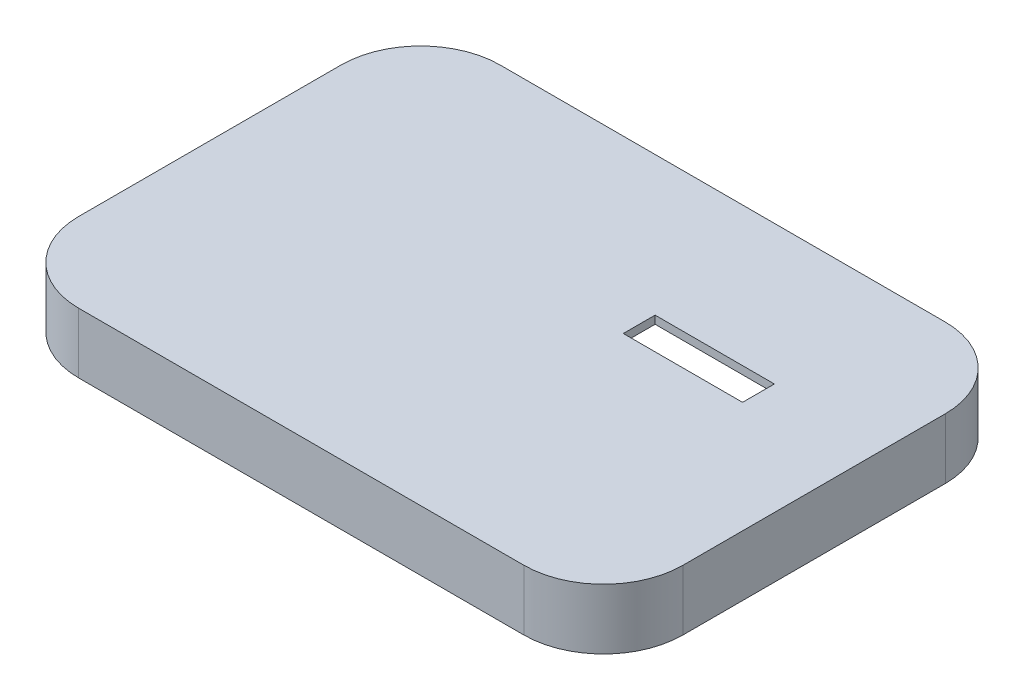
from build123d import *

# Parameters (mm, degrees)
SKETCH1_W           = 15
SKETCH1_H           = 4
BOSS_EXTRUDE1_DEPTH = 1
BOSS_EXTRUDE2_START = 6
BOSS_EXTRUDE2_DEPTH = 6
SKETCH3_W           = 10
SKETCH3_H           = 3
BOSS_EXTRUDE3_DEPTH = 3.5
BOSS_EXTRUDE4_START = 0.6
BOSS_EXTRUDE4_DEPTH = 0.6
SKETCH5_W           = 3
SKETCH5_H           = 10
BOSS_EXTRUDE5_DEPTH = 3.5


with BuildPart() as part:
    # Sketch1 → Boss-Extrude1 (new body)
    with BuildSketch(Plane(origin=(0, 0, 0), x_dir=(1, 0, 0), z_dir=(0, 1, 0))):
        with BuildLine():
            Line((-28, -26.5), (28, -26.5))
            ThreePointArc((28, -26.5), (35.071067812, -23.571067812), (38, -16.5))
            Line((38, -16.5), (38, 16.5))
            ThreePointArc((38, 16.5), (35.071067812, 23.571067812), (28, 26.5))
            Line((28, 26.5), (-28, 26.5))
            ThreePointArc((-28, 26.5), (-35.071067812, 23.571067812), (-38, 16.5))
            Line((-38, 16.5), (-38, -16.5))
            ThreePointArc((-38, -16.5), (-35.071067812, -23.571067812), (-28, -26.5))
        make_face()
        with Locations((16.5, 7)):
            Rectangle(SKETCH1_W, SKETCH1_H, mode=Mode.SUBTRACT)
    extrude(amount=BOSS_EXTRUDE1_DEPTH)

    # Sketch2 → Boss-Extrude2 (add)
    with BuildSketch(Plane.XZ.offset(BOSS_EXTRUDE2_START)):
        with BuildLine():
            Line((-28, -26.5), (28, -26.5))
            ThreePointArc((28, -26.5), (35.071067812, -23.571067812), (38, -16.5))
            Line((38, -16.5), (38, 16.5))
            ThreePointArc((38, 16.5), (35.071067812, 23.571067812), (28, 26.5))
            Line((28, 26.5), (-28, 26.5))
            ThreePointArc((-28, 26.5), (-35.071067812, 23.571067812), (-38, 16.5))
            Line((-38, 16.5), (-38, -16.5))
            ThreePointArc((-38, -16.5), (-35.071067812, -23.571067812), (-28, -26.5))
        make_face()
        with BuildLine():
            Line((28, 25.5), (-28, 25.5))
            ThreePointArc((-28, 25.5), (-34.363961031, 22.863961031), (-37, 16.5))
            Line((-37, 16.5), (-37, -16.5))
            ThreePointArc((-37, -16.5), (-34.363961031, -22.863961031), (-28, -25.5))
            Line((-28, -25.5), (28, -25.5))
            ThreePointArc((28, -25.5), (34.363961031, -22.863961031), (37, -16.5))
            Line((37, -16.5), (37, 16.5))
            ThreePointArc((37, 16.5), (34.363961031, 22.863961031), (28, 25.5))
        make_face(mode=Mode.SUBTRACT)
    extrude(amount=-BOSS_EXTRUDE2_DEPTH)

    # Sketch3 → Boss-Extrude3 (add)
    with BuildSketch(Plane.XZ):
        with Locations((0, -24)):
            Rectangle(SKETCH3_W, SKETCH3_H)
        with Locations((0, 24)):
            Rectangle(SKETCH3_W, SKETCH3_H)
    extrude(amount=BOSS_EXTRUDE3_DEPTH)

    # Sketch4 → Boss-Extrude4 (add)
    with BuildSketch(Plane.XZ.offset(6).offset(BOSS_EXTRUDE4_START)):
        with BuildLine():
            Line((-28, -26.5), (28, -26.5))
            ThreePointArc((28, -26.5), (35.071067812, -23.571067812), (38, -16.5))
            Line((38, -16.5), (38, 16.5))
            ThreePointArc((38, 16.5), (35.071067812, 23.571067812), (28, 26.5))
            Line((28, 26.5), (-28, 26.5))
            ThreePointArc((-28, 26.5), (-35.071067812, 23.571067812), (-38, 16.5))
            Line((-38, 16.5), (-38, -16.5))
            ThreePointArc((-38, -16.5), (-35.071067812, -23.571067812), (-28, -26.5))
        make_face()
        with BuildLine():
            Line((28, 25), (-28, 25))
            ThreePointArc((-28, 25), (-34.01040764, 22.51040764), (-36.5, 16.5))
            Line((-36.5, 16.5), (-36.5, -16.5))
            ThreePointArc((-36.5, -16.5), (-34.01040764, -22.51040764), (-28, -25))
            Line((-28, -25), (28, -25))
            ThreePointArc((28, -25), (34.01040764, -22.51040764), (36.5, -16.5))
            Line((36.5, -16.5), (36.5, 16.5))
            ThreePointArc((36.5, 16.5), (34.01040764, 22.51040764), (28, 25))
        make_face(mode=Mode.SUBTRACT)
    extrude(amount=-BOSS_EXTRUDE4_DEPTH)

    # Sketch5 → Boss-Extrude5 (add)
    with BuildSketch(Plane.XZ):
        with Locations((35.5, 0)):
            Rectangle(SKETCH5_W, SKETCH5_H)
        with Locations((-35.5, 0)):
            Rectangle(SKETCH5_W, SKETCH5_H)
    extrude(amount=BOSS_EXTRUDE5_DEPTH)


solid = part.part
